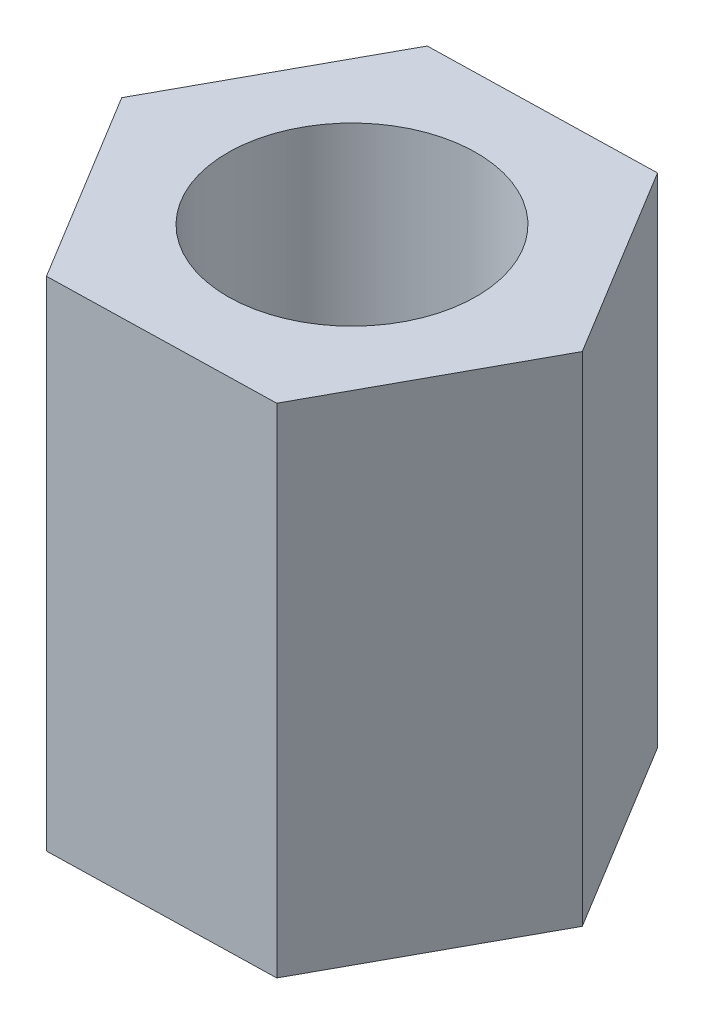
from build123d import *

# Parameters (mm, degrees)
SKETCH_1_R      = 1.5
EXTRUDE_1_DEPTH = 6


with BuildPart() as part:
    # 草图1 → 凸台-拉伸1 (new body)
    with BuildSketch(Plane(origin=(0, 0, 0), x_dir=(1, 0, 0), z_dir=(0, 1, 0))):
        Polygon((1.410900096, -2.3179073), (2.712816654, 0.062921675), (1.301916558, 2.380828975), (-1.410900096, 2.3179073), (-2.712816654, -0.062921675), (-1.301916558, -2.380828975), align=None)
        with Locations(Location((0, 0, 0), (0, 0, 270))):
            Circle(SKETCH_1_R, mode=Mode.SUBTRACT)
    extrude(amount=EXTRUDE_1_DEPTH)


solid = part.part
